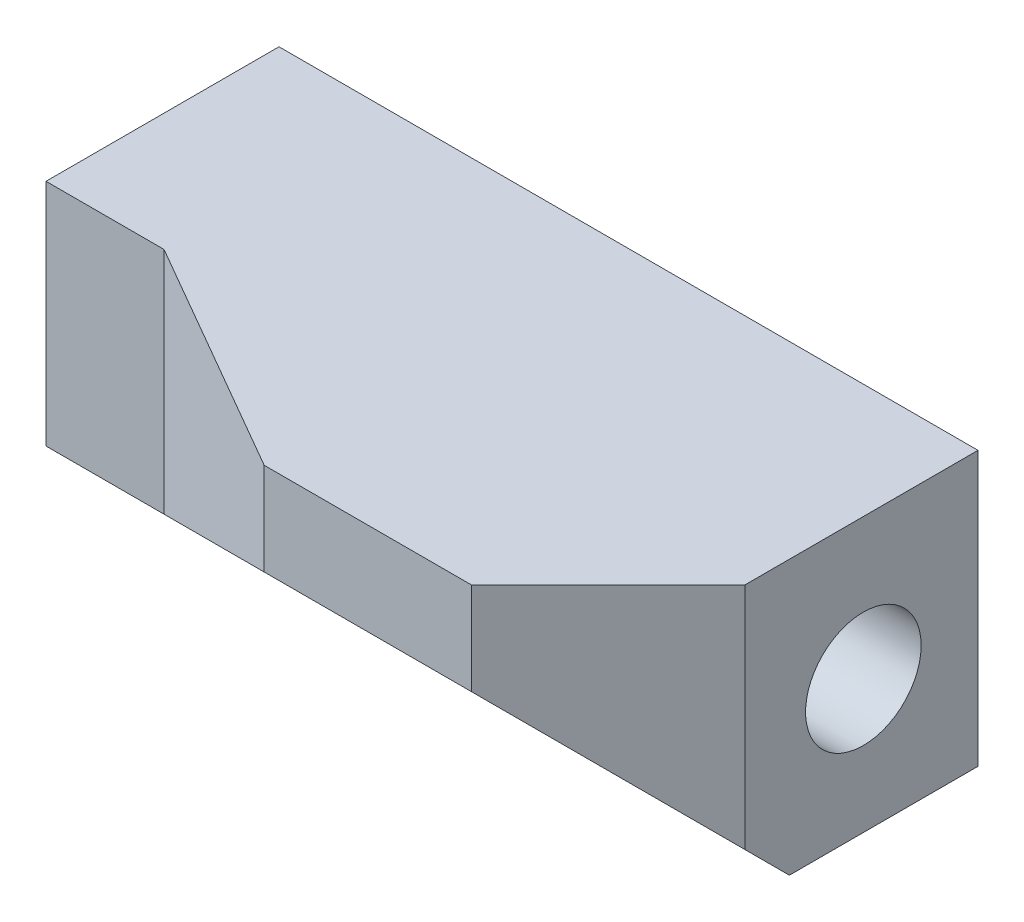
from build123d import *

# Parameters (mm, degrees)
BOSS_EXTRUDE1_DEPTH = 96.012
SKETCH1_3_R         = 7.9375
CUT_EXTRUDE1_DEPTH  = 31.75
SKETCH3_W           = 28.956
SKETCH3_H           = 13.716
SKETCH3_W_2         = 25.4
SKETCH3_H_2         = 19.304
CUT_EXTRUDE2_DEPTH  = 123.621771966
CUT_EXTRUDE3_DEPTH  = 123.621771966


with BuildPart() as part:
    # Sketch1 → Boss-Extrude1 (new body)
    with BuildSketch(Plane.YZ):
        Polygon((-56.896, 0), (0, 0), (0, 50.8), (-12.7, 50.8), (-56.896, 6.604), align=None)
    extrude(amount=-BOSS_EXTRUDE1_DEPTH)

    # Sketch1<3> → Cut-Extrude1 (cut)
    with BuildSketch(Plane.YZ):
        with Locations((-19.304, 15.748)):
            Circle(SKETCH1_3_R)
    extrude(amount=-CUT_EXTRUDE1_DEPTH, mode=Mode.SUBTRACT)

    # Sketch3 → Cut-Extrude2 (cut, through all)
    with BuildSketch(Plane(origin=(0, 0, 0), x_dir=(1, 0, 0), z_dir=(0, 0, -1))):
        with Locations((-56.134, 50.038)):
            Rectangle(SKETCH3_W, SKETCH3_H)
        with Locations((-12.7, 47.244)):
            Rectangle(SKETCH3_W_2, SKETCH3_H_2)
    extrude(amount=-CUT_EXTRUDE2_DEPTH, mode=Mode.SUBTRACT)

    # Sketch4 → Cut-Extrude3 (cut, through all)
    with BuildSketch(Plane(origin=(0, 0, 0), x_dir=(-1, 0, 0), z_dir=(0, 1, 0))):
        Polygon((96.012, 50.8), (47.244, 50.8), (79.799626979, 32.004), (96.012, 32.004), align=None)
        Polygon((0, 32.004), (18.796, 50.8), (0, 50.8), align=None)
    extrude(amount=-CUT_EXTRUDE3_DEPTH, mode=Mode.SUBTRACT)


solid = part.part
